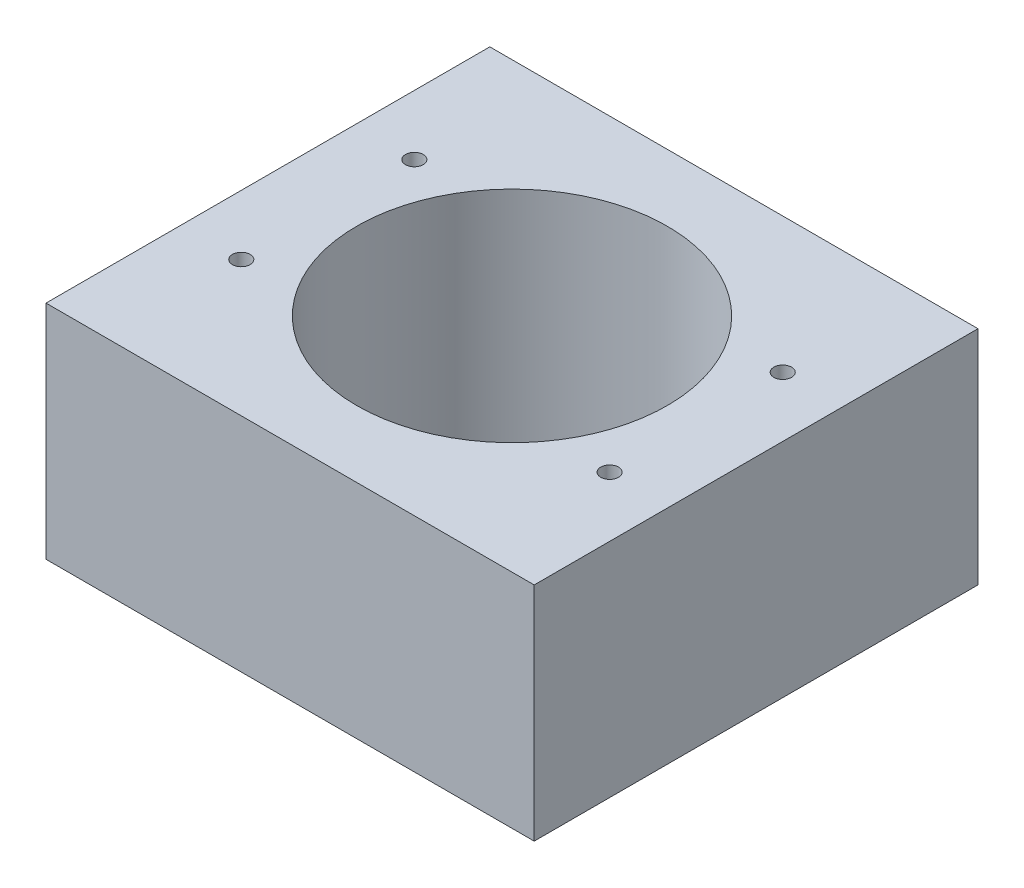
from build123d import *

# Parameters (mm, degrees)
SKETCH1_W               = 110
SKETCH1_H               = 100
BOSS_EXTRUDE1_DEPTH     = 50
SKETCH2_R               = 35
CUT_EXTRUDE1_DEPTH      = 50
SKETCH3_R               = 2
CUT_EXTRUDE2_DEPTH      = 50
MIRROR3_COPY_1_SKETCH_R = 2
MIRROR3_COPY_1_DEPTH    = 50
MIRROR3_COPY_2_SKETCH_R = 2
MIRROR3_COPY_2_DEPTH    = 50


with BuildPart() as part:
    # Sketch1 → Boss-Extrude1 (new body)
    with BuildSketch(Plane(origin=(0, 0, 0), x_dir=(1, 0, 0), z_dir=(0, 1, 0))):
        Rectangle(SKETCH1_W, SKETCH1_H)
    extrude(amount=BOSS_EXTRUDE1_DEPTH)

    # Sketch2 → Cut-Extrude1 (cut)
    with BuildSketch(Plane(origin=(0, 0, 0), x_dir=(1, 0, 0), z_dir=(0, 1, 0))):
        with Locations(Location((0, 0, 0), (0, 0, 270))):
            Circle(SKETCH2_R)
    extrude(amount=CUT_EXTRUDE1_DEPTH, mode=Mode.SUBTRACT)

    # Sketch3 → Cut-Extrude2 (cut)
    with BuildSketch(Plane(origin=(0, 0, 0), x_dir=(1, 0, 0), z_dir=(0, 1, 0))):
        with Locations(Location((41.5, -19.5, 0), (0, 0, 270))):
            Circle(SKETCH3_R)
    cut_extrude2 = extrude(amount=CUT_EXTRUDE2_DEPTH, mode=Mode.SUBTRACT)

    # Mirror1: Cut-Extrude2 across plane
    add(cut_extrude2.mirror(Plane.XY), mode=Mode.SUBTRACT)

    # Mirror2: Cut-Extrude2 across plane
    add(cut_extrude2.mirror(Plane(origin=(0, 0, 0), x_dir=(0, 0, 1), z_dir=(1, 0, 0))), mode=Mode.SUBTRACT)

    # Mirror3 copy 1 sketch → Mirror3 copy 1 (cut)
    with BuildSketch(Plane(origin=(0, 0, 0), x_dir=(-1, 0, 0), z_dir=(0, 1, 0))):
        with Locations(Location((41.5, -19.5, 0), (0, 0, 270))):
            Circle(MIRROR3_COPY_1_SKETCH_R)
    extrude(amount=MIRROR3_COPY_1_DEPTH, mode=Mode.SUBTRACT)

    # Mirror3 copy 2 sketch → Mirror3 copy 2 (cut)
    with BuildSketch(Plane(origin=(0, 0, 0), x_dir=(1, 0, 0), z_dir=(0, 1, 0))):
        with Locations((41.5, 19.5)):
            Circle(MIRROR3_COPY_2_SKETCH_R)
    extrude(amount=MIRROR3_COPY_2_DEPTH, mode=Mode.SUBTRACT)


solid = part.part
